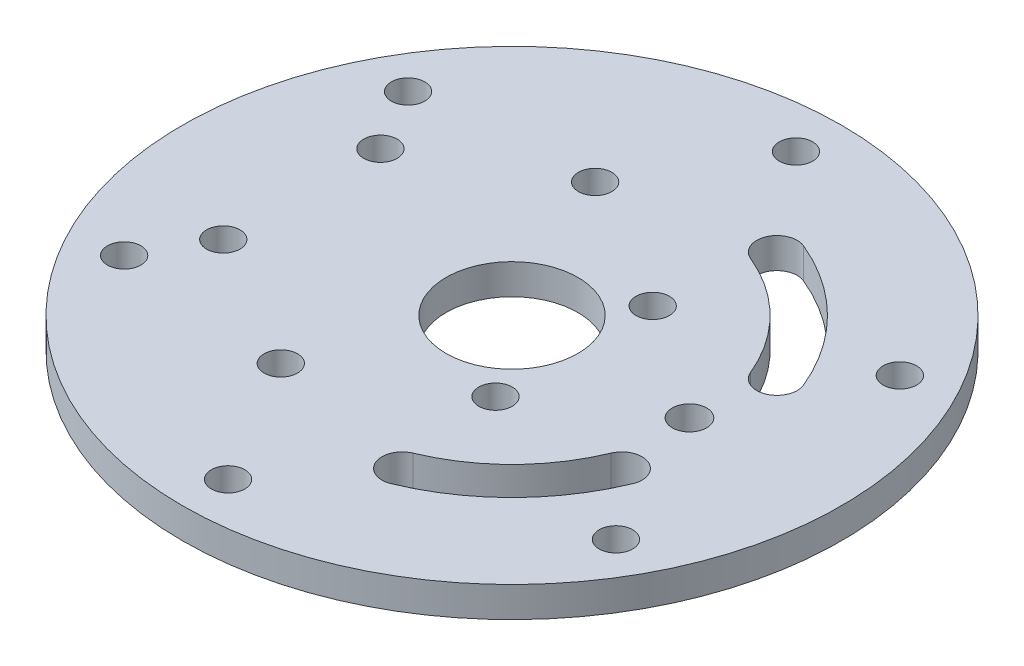
from build123d import *

# Parameters (mm, degrees)
SKETCH_1_R      = 32.5
SKETCH_1_R_2    = 6.5
SKETCH_1_R_3    = 1.65
SKETCH_1_R_4    = 1.7
EXTRUDE_1_DEPTH = 3


with BuildPart() as part:
    # 草图1 → 凸台-拉伸1 (new body)
    with BuildSketch(Plane(origin=(0, 0, 0), x_dir=(1, 0, 0), z_dir=(0, 1, 0))):
        with Locations(Location((0, 0, 0), (0, 0, 270))):
            Circle(SKETCH_1_R)
        with Locations(Location((0, 0, 0), (0, 0, 270))):
            Circle(SKETCH_1_R_2, mode=Mode.SUBTRACT)
        with Locations(Location((-7.3, 15.5, 0), (0, 0, 270))):
            Circle(SKETCH_1_R_3, mode=Mode.SUBTRACT)
        with Locations(Location((6.123393759, 7.75, 0), (0, 0, 270))):
            Circle(SKETCH_1_R_3, mode=Mode.SUBTRACT)
        with Locations(Location((6.123393759, -7.75, 0), (0, 0, 270))):
            Circle(SKETCH_1_R_3, mode=Mode.SUBTRACT)
        with Locations(Location((-7.3, -15.5, 0), (0, 0, 270))):
            Circle(SKETCH_1_R_3, mode=Mode.SUBTRACT)
        with Locations(Location((-20.723393759, -7.75, 0), (0, 0, 270))):
            Circle(SKETCH_1_R_3, mode=Mode.SUBTRACT)
        with Locations(Location((-20.723393759, 7.75, 0), (0, 0, 270))):
            Circle(SKETCH_1_R_3, mode=Mode.SUBTRACT)
        with Locations(Location((17.5, 0, 0), (0, 0, 270))):
            Circle(SKETCH_1_R_4, mode=Mode.SUBTRACT)
        with Locations(Location((0, 28, 0), (0, 0, 270))):
            Circle(SKETCH_1_R_3, mode=Mode.SUBTRACT)
        with Locations(Location((24.248711306, 14, 0), (0, 0, 270))):
            Circle(SKETCH_1_R_3, mode=Mode.SUBTRACT)
        with Locations(Location((24.248711306, -14, 0), (0, 0, 270))):
            Circle(SKETCH_1_R_3, mode=Mode.SUBTRACT)
        with Locations(Location((0, -28, 0), (0, 0, 270))):
            Circle(SKETCH_1_R_3, mode=Mode.SUBTRACT)
        with Locations(Location((-24.248711306, -14, 0), (0, 0, 270))):
            Circle(SKETCH_1_R_3, mode=Mode.SUBTRACT)
        with Locations(Location((-24.248711306, 14, 0), (0, 0, 270))):
            Circle(SKETCH_1_R_3, mode=Mode.SUBTRACT)
        with BuildLine():
            ThreePointArc((8.419035512, -20.325349715), (15.556349186, -15.556349186), (20.325349715, -8.419035512))
            ThreePointArc((20.325349715, -8.419035512), (19.242957515, -5.805909582), (16.629831585, -6.888301783))
            ThreePointArc((16.629831585, -6.888301783), (12.727922061, -12.727922061), (6.888301783, -16.629831585))
            ThreePointArc((6.888301783, -16.629831585), (5.805909582, -19.242957515), (8.419035512, -20.325349715))
        make_face(mode=Mode.SUBTRACT)
        with BuildLine():
            ThreePointArc((8.419035512, 20.325349715), (15.556349186, 15.556349186), (20.325349715, 8.419035512))
            ThreePointArc((20.325349715, 8.419035512), (19.242957515, 5.805909582), (16.629831585, 6.888301783))
            ThreePointArc((16.629831585, 6.888301783), (12.727922061, 12.727922061), (6.888301783, 16.629831585))
            ThreePointArc((6.888301783, 16.629831585), (5.805909582, 19.242957515), (8.419035512, 20.325349715))
        make_face(mode=Mode.SUBTRACT)
    extrude(amount=EXTRUDE_1_DEPTH)


solid = part.part
